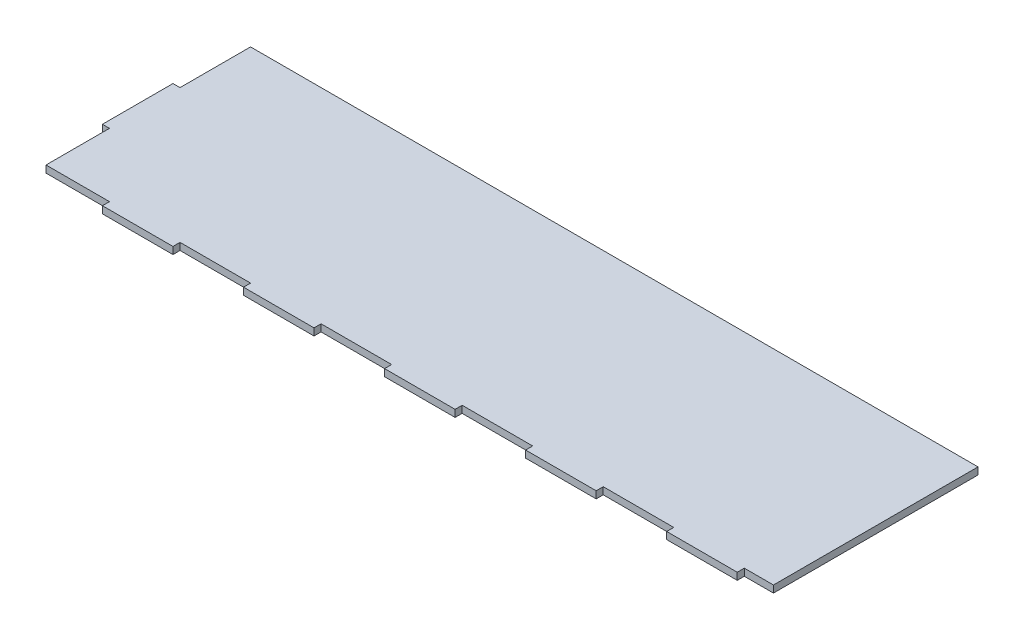
from build123d import *

# Parameters (mm, degrees)
SKETCH1_W           = 630
SKETCH1_H           = 90
BOSS_EXTRUDE1_DEPTH = 3
SKETCH3_W           = 30
SKETCH3_H           = 3
CUT_EXTRUDE1_DEPTH  = 3
LPATTERN1_COUNT     = 10
LPATTERN1_PITCH     = 60
LPATTERN1_COL_COUNT = 2
LPATTERN1_COL_PITCH = 60
SKETCH7_W           = 3
SKETCH7_H           = 30
CUT_EXTRUDE3_DEPTH  = 3
SKETCH13_W          = 3
SKETCH13_H          = 27
CUT_EXTRUDE4_DEPTH  = 10


with BuildPart() as part:
    # Sketch1 → Boss-Extrude1 (new body)
    with BuildSketch(Plane(origin=(0, 0, 0), x_dir=(1, 0, 0), z_dir=(0, 1, 0))):
        Rectangle(SKETCH1_W, SKETCH1_H)
    extrude(amount=BOSS_EXTRUDE1_DEPTH)

    # Sketch3 → Cut-Extrude1 (cut)
    with BuildSketch(Plane(origin=(0, 3, 0), x_dir=(1, 0, 0), z_dir=(0, 1, 0))):
        with Locations((-240, -43.5)):
            Rectangle(SKETCH3_W, SKETCH3_H)
    cut_extrude1 = extrude(amount=-CUT_EXTRUDE1_DEPTH, mode=Mode.SUBTRACT)

    # LPattern1: Cut-Extrude1 ×10
    with Locations(*[(i * LPATTERN1_PITCH, 0, 0) for i in range(1, LPATTERN1_COUNT)]):
        add(cut_extrude1, mode=Mode.SUBTRACT)

    # LPattern1 col: Cut-Extrude1 ×2
    with Locations(*[(-i * LPATTERN1_COL_PITCH, 0, 0) for i in range(1, LPATTERN1_COL_COUNT)]):
        add(cut_extrude1, mode=Mode.SUBTRACT)

    # Sketch7 → Cut-Extrude3 (cut)
    with BuildSketch(Plane(origin=(0, 3, 0), x_dir=(1, 0, 0), z_dir=(0, 1, 0))):
        with Locations((-313.5, 30)):
            Rectangle(SKETCH7_W, SKETCH7_H)
    extrude(amount=-CUT_EXTRUDE3_DEPTH, mode=Mode.SUBTRACT)

    # Sketch13 → Cut-Extrude4 (cut)
    with BuildSketch(Plane(origin=(0, 3, 0), x_dir=(1, 0, 0), z_dir=(0, 1, 0))):
        with Locations((-313.5, -28.5)):
            Rectangle(SKETCH13_W, SKETCH13_H)
    extrude(amount=-CUT_EXTRUDE4_DEPTH, mode=Mode.SUBTRACT)

    # SurfaceCut1
    split(bisect_by=Plane(origin=(-2.6, 0, 0), x_dir=(0, 0, -1), z_dir=(1, 0, 0)), keep=Keep.BOTTOM)


solid = part.part
